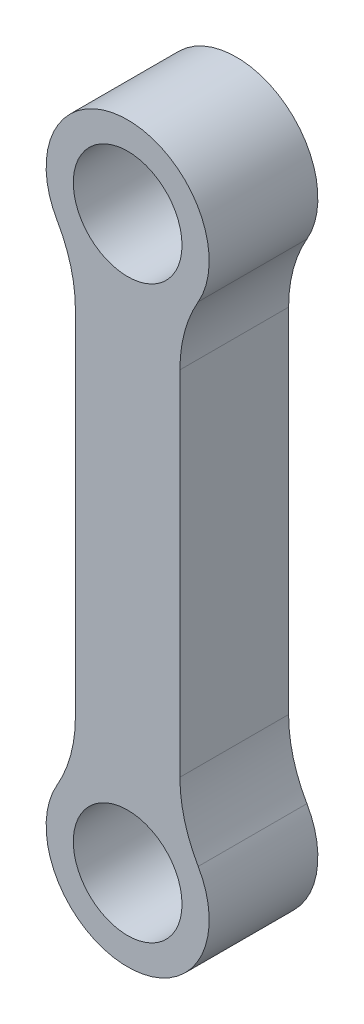
from build123d import *

# Parameters (mm, degrees)
SKETCH6_R             = 3
BOSS_EXTRUDE4_DEPTH   = 4
BOSS_EXTRUDE4_2_DEPTH = 4
SKETCH7_R             = 2
CUT_EXTRUDE3_DEPTH    = 4
SKETCH8_W             = 3.845886706
SKETCH8_H             = 17
BOSS_EXTRUDE5_DEPTH   = 4
FILLET1_R             = 5
BOSS_EXTRUDE6_START   = -0.5
SKETCH9_R             = 2
BOSS_EXTRUDE6_DEPTH   = 0.5
SKETCH10_R            = 1.5
CUT_EXTRUDE4_DEPTH    = 0.5
BOSS_EXTRUDE7_START   = -0.5
SKETCH11_R            = 2
BOSS_EXTRUDE7_DEPTH   = 0.5
SKETCH12_R            = 1.5
CUT_EXTRUDE5_DEPTH    = 0.5


with BuildPart() as part:
    # Sketch6 → Boss-Extrude4 (new body)
    with BuildSketch(Plane.XY):
        Circle(SKETCH6_R)
    extrude(amount=BOSS_EXTRUDE4_DEPTH)


with BuildPart() as body_2:
    # Sketch6 → Boss-Extrude4 2 (new body)
    with BuildSketch(Plane.XY):
        with Locations((0, 21)):
            Circle(SKETCH6_R)
    extrude(amount=BOSS_EXTRUDE4_2_DEPTH)


with BuildPart() as cut_extrude3_tool:
    # Sketch7 → Cut-Extrude3 (new body)
    with BuildSketch(Plane.XY.offset(4)):
        with Locations((0, 21)):
            Circle(SKETCH7_R)
        Circle(SKETCH7_R)
    extrude(amount=-CUT_EXTRUDE3_DEPTH)


with BuildPart() as part_1:
    add(part.part)

    # Cut-Extrude3: cut by cut_extrude3_tool
    add(cut_extrude3_tool.part, mode=Mode.SUBTRACT)



with BuildPart() as body_2_1:
    add(body_2.part)

    # Cut-Extrude3: cut by cut_extrude3_tool
    add(cut_extrude3_tool.part, mode=Mode.SUBTRACT)


with BuildPart() as part_2:
    add(part_1.part)

    add(body_2_1.part)  # Boss-Extrude5 merges body 2
    # Sketch8 → Boss-Extrude5 (add)
    with BuildSketch(Plane.XY.offset(4)):
        with Locations((0, 10.5)):
            Rectangle(SKETCH8_W, SKETCH8_H)
    extrude(amount=-BOSS_EXTRUDE5_DEPTH)

    # Fillet1
    fillet1_edges = [part_2.edges().sort_by_distance(p)[0] for p in [
        (-1.922943353, 2.302669942, 2),
        (1.922943353, 2.302669942, 2),
        (1.922943353, 18.697330058, 2),
        (-1.922943353, 18.697330058, 2),
    ]]
    fillet(fillet1_edges, radius=FILLET1_R)

    # Sketch9 → Boss-Extrude6 (add)
    with BuildSketch(Plane(origin=(0, 0, 0), x_dir=(-1, 0, 0), z_dir=(0, 0, -1)).offset(BOSS_EXTRUDE6_START)):
        with Locations(Location((0, 21, 0), (0, 0, 180))):
            Circle(SKETCH9_R)
    extrude(amount=BOSS_EXTRUDE6_DEPTH)

    # Sketch10 → Cut-Extrude4 (cut)
    with BuildSketch(Plane.XY.offset(0.5)):
        with Locations((0, 21)):
            Circle(SKETCH10_R)
    extrude(amount=-CUT_EXTRUDE4_DEPTH, mode=Mode.SUBTRACT)

    # Sketch11 → Boss-Extrude7 (add)
    with BuildSketch(Plane(origin=(0, 0, 0), x_dir=(-1, 0, 0), z_dir=(0, 0, -1)).offset(BOSS_EXTRUDE7_START)):
        with Locations(Location((0, 0, 0), (0, 0, 180))):
            Circle(SKETCH11_R)
    extrude(amount=BOSS_EXTRUDE7_DEPTH)

    # Sketch12 → Cut-Extrude5 (cut)
    with BuildSketch(Plane.XY.offset(0.5)):
        Circle(SKETCH12_R)
    extrude(amount=-CUT_EXTRUDE5_DEPTH, mode=Mode.SUBTRACT)


solid = part_2.part
